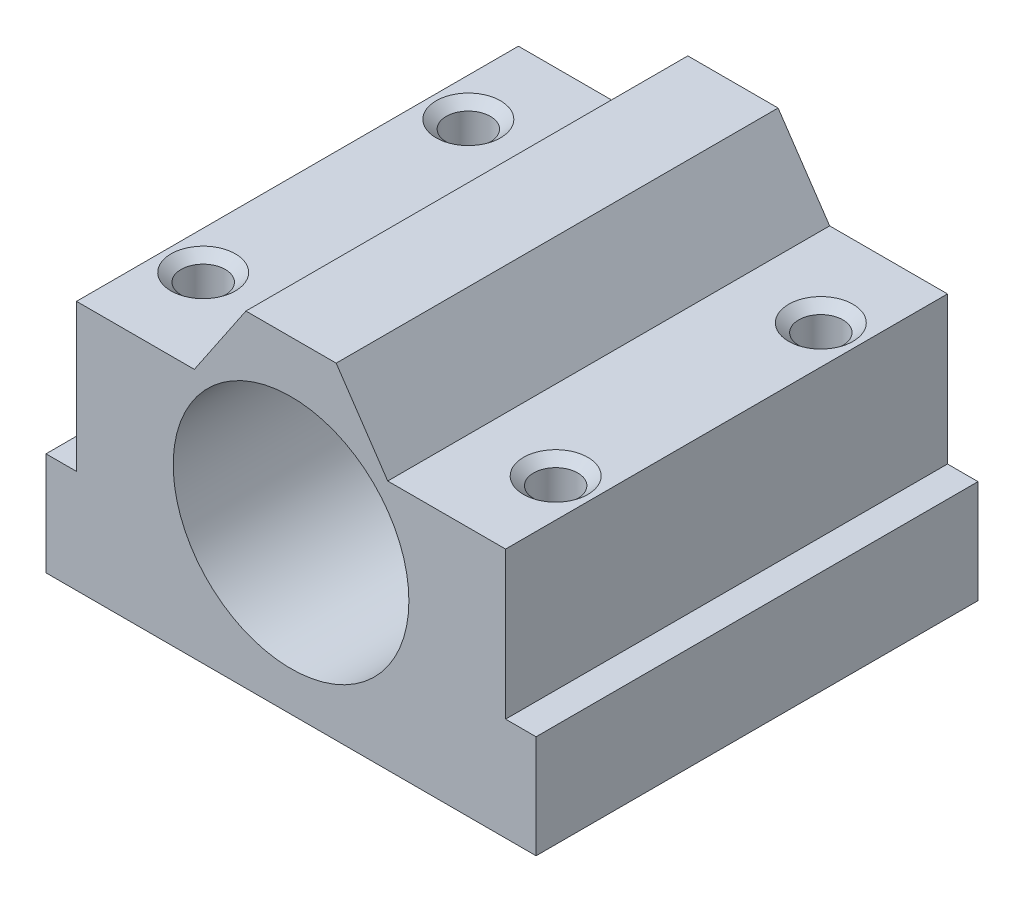
from build123d import *

# Parameters (mm, degrees)
SKETCH1_R                                         = 8
BOSS_EXTRUDE1_DEPTH                               = 30
SKETCH2_R                                         = 1.5
CUT_EXTRUDE2_DEPTH                                = 30
CSK_FOR_2_FLAT_HEAD_MACHINE_SCREW_100_D           = 2.7051
CSK_FOR_2_FLAT_HEAD_MACHINE_SCREW_100_CSINK_D     = 4.3688
CSK_FOR_2_FLAT_HEAD_MACHINE_SCREW_100_CSINK_ANGLE = 100
CSK_FOR_2_FLAT_HEAD_MACHINE_SCREW_2_D             = 2.7051
CSK_FOR_2_FLAT_HEAD_MACHINE_SCREW_2_CSINK_D       = 4.3688
CSK_FOR_2_FLAT_HEAD_MACHINE_SCREW_2_CSINK_ANGLE   = 100
CSK_FOR_2_FLAT_HEAD_MACHINE_SCREW_3_D             = 2.7051
CSK_FOR_2_FLAT_HEAD_MACHINE_SCREW_3_CSINK_D       = 4.3688
CSK_FOR_2_FLAT_HEAD_MACHINE_SCREW_3_CSINK_ANGLE   = 100
CSK_FOR_2_FLAT_HEAD_MACHINE_SCREW_4_D             = 2.7051
CSK_FOR_2_FLAT_HEAD_MACHINE_SCREW_4_CSINK_D       = 4.3688
CSK_FOR_2_FLAT_HEAD_MACHINE_SCREW_4_CSINK_ANGLE   = 100


with BuildPart() as part:
    # Sketch1 → Boss-Extrude1 (new body)
    with BuildSketch(Plane.XY):
        Polygon((33.27, 7), (31.19936412, 7), (31.19936412, 17), (23.19936412, 17), (19.69936412, 22.18), (13.57063588, 22.18), (10.07063588, 17), (2.07063588, 17), (2.07063588, 7), (0, 7), (0, 0), (33.27, 0), align=None)
        with Locations((16.635, 10.68)):
            Circle(SKETCH1_R, mode=Mode.SUBTRACT)
    extrude(amount=BOSS_EXTRUDE1_DEPTH)

    # Sketch2 → Cut-Extrude2 (cut)
    with BuildSketch(Plane(origin=(0, 17, 0), x_dir=(1, 0, 0), z_dir=(0, 1, 0))):
        with Locations(Location((28.59936412, -6, 0), (0, 0, 270))):
            Circle(SKETCH2_R)
        with Locations(Location((28.59936412, -24, 0), (0, 0, 270))):
            Circle(SKETCH2_R)
        with Locations(Location((4.67063588, -24, 0), (0, 0, 270))):
            Circle(SKETCH2_R)
        with Locations(Location((4.67063588, -6, 0), (0, 0, 270))):
            Circle(SKETCH2_R)
    extrude(amount=-CUT_EXTRUDE2_DEPTH, mode=Mode.SUBTRACT)

    # CSK for _2 Flat Head Machine Screw _100 (through all)
    with Locations(Plane(origin=(0, 17, 0), x_dir=(1, 0, 0), z_dir=(0, 1, 0))):
        with Locations((4.67063588, -6)):
            CounterSinkHole(CSK_FOR_2_FLAT_HEAD_MACHINE_SCREW_100_D / 2, CSK_FOR_2_FLAT_HEAD_MACHINE_SCREW_100_CSINK_D / 2, counter_sink_angle=CSK_FOR_2_FLAT_HEAD_MACHINE_SCREW_100_CSINK_ANGLE)

    # CSK for _2 Flat Head Machine Screw _ 2 (through all)
    with Locations(Plane(origin=(0, 17, 0), x_dir=(1, 0, 0), z_dir=(0, 1, 0))):
        with Locations((4.67063588, -24)):
            CounterSinkHole(CSK_FOR_2_FLAT_HEAD_MACHINE_SCREW_2_D / 2, CSK_FOR_2_FLAT_HEAD_MACHINE_SCREW_2_CSINK_D / 2, counter_sink_angle=CSK_FOR_2_FLAT_HEAD_MACHINE_SCREW_2_CSINK_ANGLE)

    # CSK for _2 Flat Head Machine Screw _ 3 (through all)
    with Locations(Plane(origin=(0, 17, 0), x_dir=(1, 0, 0), z_dir=(0, 1, 0))):
        with Locations((28.59936412, -6)):
            CounterSinkHole(CSK_FOR_2_FLAT_HEAD_MACHINE_SCREW_3_D / 2, CSK_FOR_2_FLAT_HEAD_MACHINE_SCREW_3_CSINK_D / 2, counter_sink_angle=CSK_FOR_2_FLAT_HEAD_MACHINE_SCREW_3_CSINK_ANGLE)

    # CSK for _2 Flat Head Machine Screw _ 4 (through all)
    with Locations(Plane(origin=(0, 17, 0), x_dir=(1, 0, 0), z_dir=(0, 1, 0))):
        with Locations((28.59936412, -24)):
            CounterSinkHole(CSK_FOR_2_FLAT_HEAD_MACHINE_SCREW_4_D / 2, CSK_FOR_2_FLAT_HEAD_MACHINE_SCREW_4_CSINK_D / 2, counter_sink_angle=CSK_FOR_2_FLAT_HEAD_MACHINE_SCREW_4_CSINK_ANGLE)


solid = part.part
